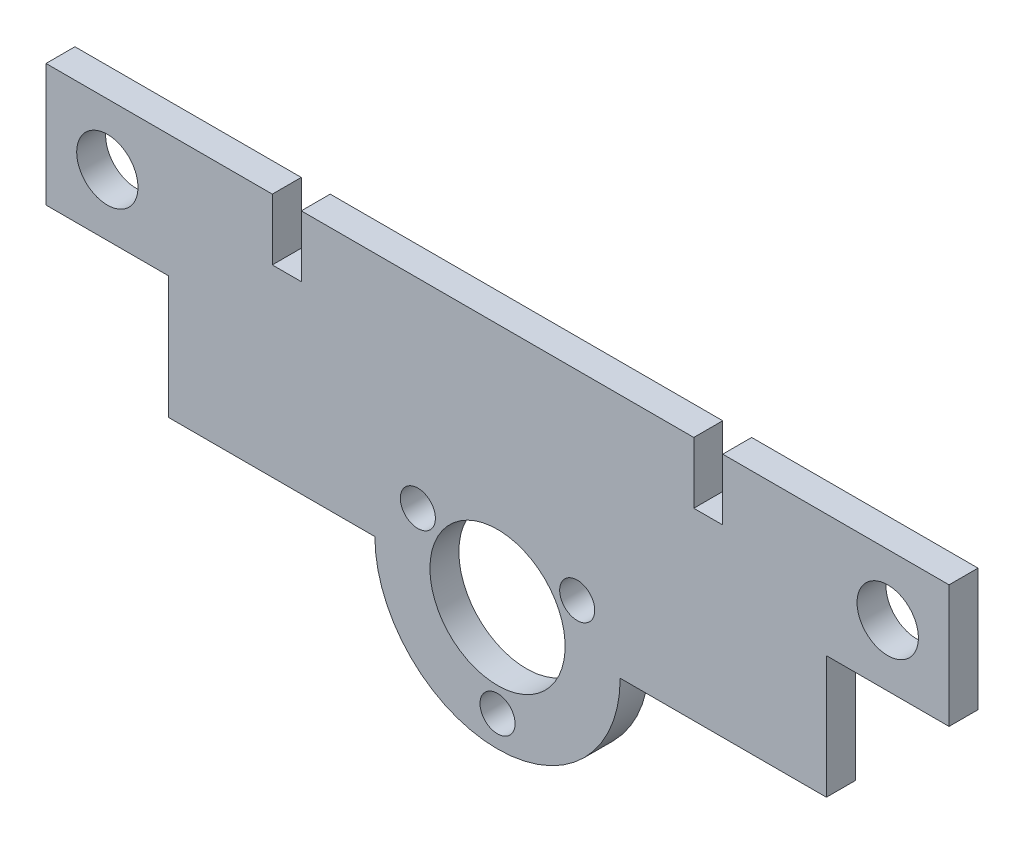
from build123d import *

# Parameters (mm, degrees)
SKETCH1_R           = 3.175
SKETCH1_R_2         = 1.8161
SKETCH1_R_3         = 7
BOSS_EXTRUDE1_DEPTH = 2.9972
SKETCH2_W           = 2.9972
SKETCH2_H           = 6.35
CUT_EXTRUDE1_DEPTH  = 59.432023179


with BuildPart() as part:
    # Sketch1 → Boss-Extrude1 (new body)
    with BuildSketch(Plane.XY):
        with BuildLine():
            Line((-34.05, 9.525), (-12.7, 9.525))
            ThreePointArc((-12.7, 9.525), (0, -3.175), (12.7, 9.525))
            Line((12.7, 9.525), (34.05, 9.525))
            Line((34.05, 9.525), (34.05, 22.225))
            Line((34.05, 22.225), (46.75, 22.225))
            Line((46.75, 22.225), (46.75, 34.925))
            Line((46.75, 34.925), (-46.75, 34.925))
            Line((-46.75, 34.925), (-46.75, 22.225))
            Line((-46.75, 22.225), (-34.05, 22.225))
            Line((-34.05, 22.225), (-34.05, 9.525))
        make_face()
        with Locations((-40.4, 28.575)):
            Circle(SKETCH1_R, mode=Mode.SUBTRACT)
        with Locations((40.4, 28.575)):
            Circle(SKETCH1_R, mode=Mode.SUBTRACT)
        with Locations((8.248891971, 14.2875)):
            Circle(SKETCH1_R_2, mode=Mode.SUBTRACT)
        with Locations((-8.248891971, 14.2875)):
            Circle(SKETCH1_R_2, mode=Mode.SUBTRACT)
        Circle(SKETCH1_R_2, mode=Mode.SUBTRACT)
        with Locations((0, 9.525)):
            Circle(SKETCH1_R_3, mode=Mode.SUBTRACT)
    extrude(amount=BOSS_EXTRUDE1_DEPTH)

    # Sketch2 → Cut-Extrude1 (cut, through all)
    with BuildSketch(Plane.XY.offset(2.9972)):
        with Locations((-21.8186, 31.75)):
            Rectangle(SKETCH2_W, SKETCH2_H)
        with Locations((21.8186, 31.75)):
            Rectangle(SKETCH2_W, SKETCH2_H)
    extrude(amount=-CUT_EXTRUDE1_DEPTH, mode=Mode.SUBTRACT)


solid = part.part
